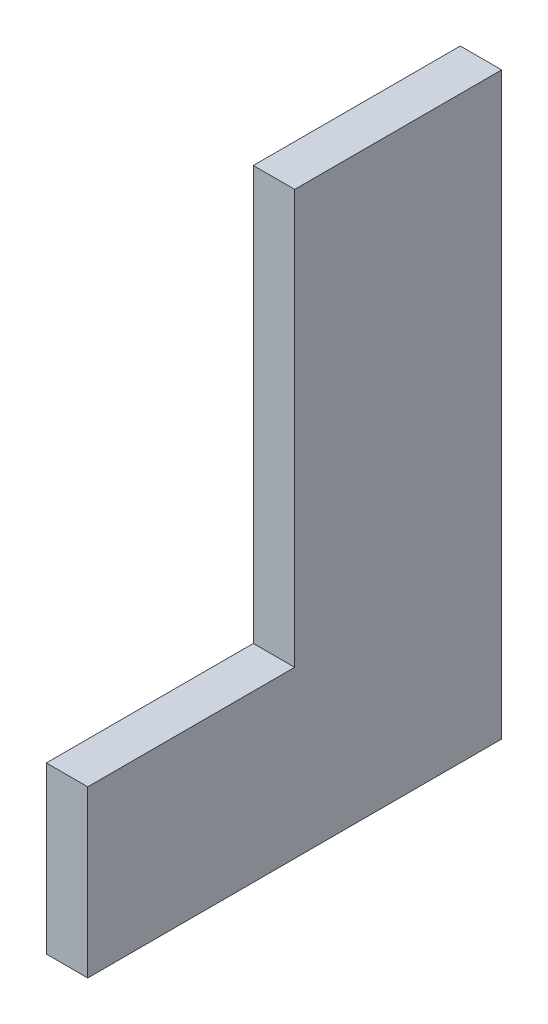
from build123d import *

# Parameters (mm, degrees)
SKETCH_1_W      = 20
SKETCH_1_H      = 280
EXTRUDE_1_DEPTH = 100
SKETCH_2_W      = 100
SKETCH_2_H      = 80
EXTRUDE_2_DEPTH = 20


with BuildPart() as part:
    # 草图1 → 凸台-拉伸1 (new body)
    with BuildSketch(Plane.XY):
        Rectangle(SKETCH_1_W, SKETCH_1_H)
    extrude(amount=EXTRUDE_1_DEPTH)

    # 草图2 → 凸台-拉伸2 (add)
    with BuildSketch(Plane.ZY.offset(10)):
        with Locations((150, -100)):
            Rectangle(SKETCH_2_W, SKETCH_2_H)
    extrude(amount=-EXTRUDE_2_DEPTH)


solid = part.part
